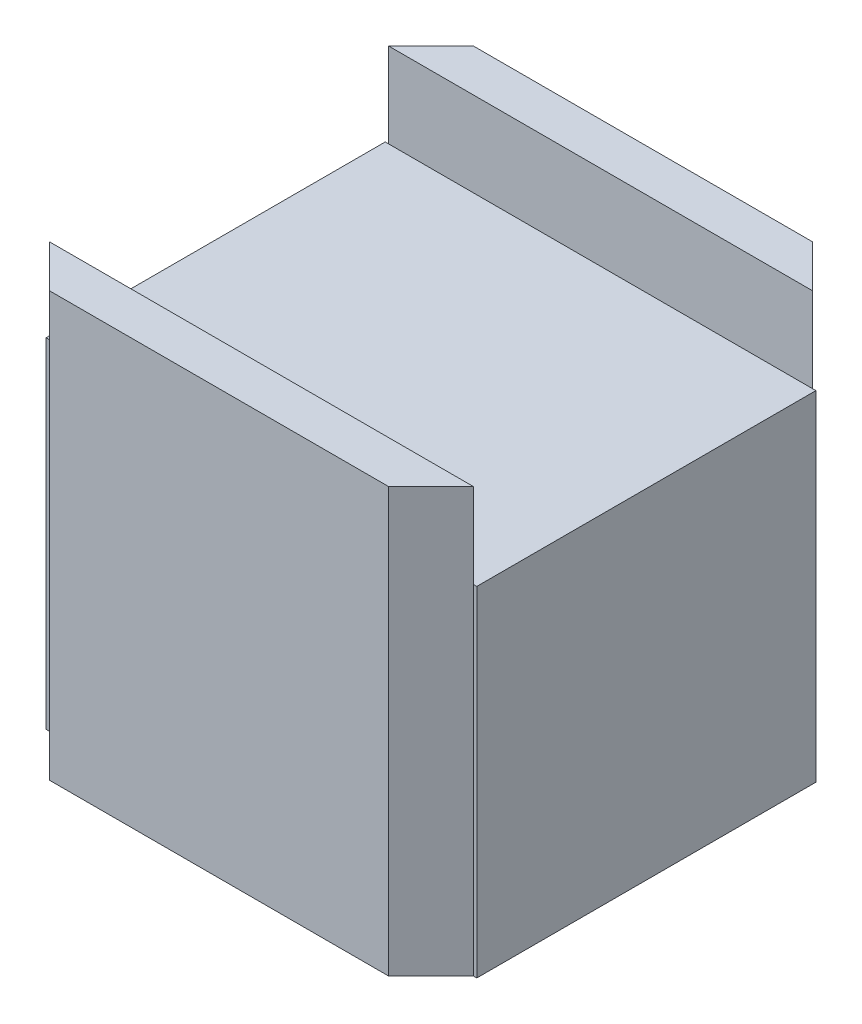
from build123d import *

# Parameters (mm, degrees)
SKETCH_1_W          = 0.02
SKETCH_1_H          = 2
SKETCH_1_W_2        = 2.5
EXTRUDE_1_DEPTH     = 2.5
SKETCH_2_W          = 2.54
SKETCH_2_H          = 2
CUT_EXTRUDE_1_DEPTH = 0.5


with BuildPart() as part:
    # Эскиз1 → Бобышка-Вытянуть1 (new body)
    with BuildSketch(Plane(origin=(0, 0, 0), x_dir=(1, 0, 0), z_dir=(0, 1, 0))):
        with Locations((-1.26, 0)):
            Rectangle(SKETCH_1_W, SKETCH_1_H)
        Rectangle(SKETCH_1_W_2, SKETCH_1_H)
        Polygon((-1, 1.25), (-1.25, 1), (1.25, 1), (1, 1.25), align=None)
        with Locations((1.26, 0)):
            Rectangle(SKETCH_1_W, SKETCH_1_H)
        Polygon((1.25, -1), (-1.25, -1), (-1, -1.25), (1, -1.25), align=None)
    extrude(amount=EXTRUDE_1_DEPTH)

    # Эскиз2 → Вырез-Вытянуть1 (cut)
    with BuildSketch(Plane(origin=(0, 2.5, 0), x_dir=(1, 0, 0), z_dir=(0, 1, 0))):
        Rectangle(SKETCH_2_W, SKETCH_2_H)
    extrude(amount=-CUT_EXTRUDE_1_DEPTH, mode=Mode.SUBTRACT)


solid = part.part
